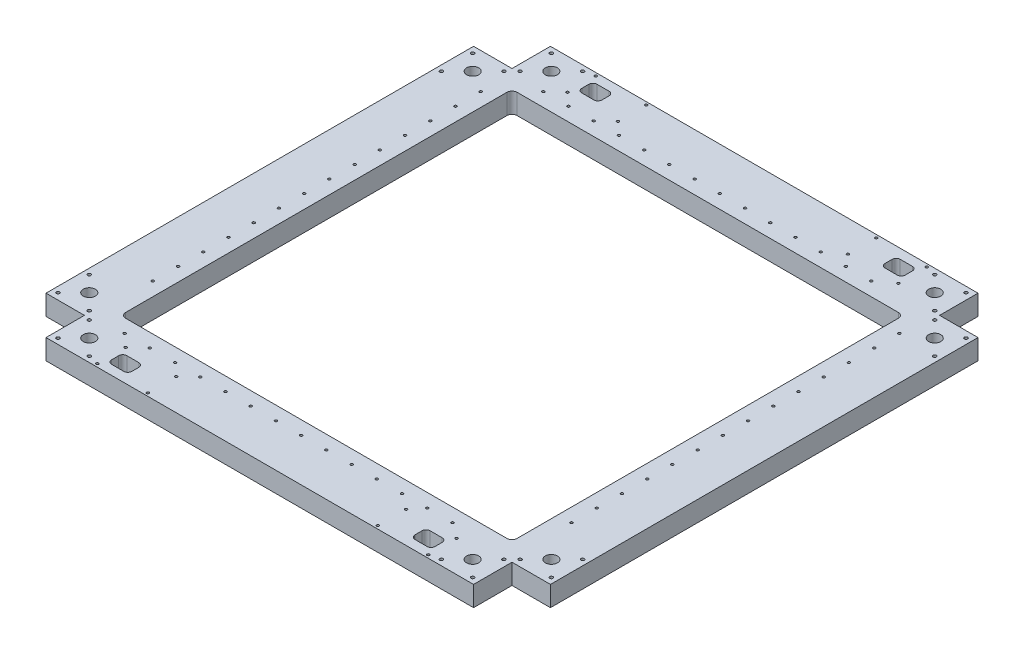
from build123d import *

# Parameters (mm, degrees)
SKETCH1_W                   = 500
SKETCH1_H                   = 500
BOSS_EXTRUDE1_DEPTH         = 20
BEARING_PRESS_FIT_D         = 12
CIRPATTERN1_COUNT           = 4
SKETCH5_W                   = 388
SKETCH5_H                   = 388
CUT_EXTRUDE1_DEPTH          = 20
SKETCH10_W                  = 428
SKETCH10_H                  = 428
SKETCH10_W_2                = 403
SKETCH10_H_2                = 403
LINEAR_RAIL_SLOT_DEPTH      = 2.5
FILLET2_R                   = 5
TAP_DRILL_FOR_M3X0_5_TAP1_D = 2.5
MIRROR6_COPY_1_D            = 2.5
BOSS_EXTRUDE2_DEPTH         = 2.5
CIRPATTERN4_COUNT           = 4
CUT_EXTRUDE3_DEPTH          = 355.118624193
TAP_DRILL_FOR_M3X0_5_TAP3_D = 2.5
MIRROR9_COPY_1_DEPTH        = 355.118624193
MIRROR9_COPY_2_D            = 2.5
M3_CLEARANCE_HOLE1_D        = 3.2
SKETCH27_W                  = 38.1
SKETCH27_H                  = 38.1
CUT_EXTRUDE4_DEPTH          = 20
CIRPATTERN3_COUNT           = 4
FILLET5_R                   = 4


with BuildPart() as part:
    # Sketch1 → Boss-Extrude1 (new body)
    with BuildSketch(Plane(origin=(0, 0, 0), x_dir=(1, 0, 0), z_dir=(0, 1, 0))):
        Rectangle(SKETCH1_W, SKETCH1_H)
    extrude(amount=BOSS_EXTRUDE1_DEPTH)

    # Bearing Press Fit (through all)
    with Locations(Plane(origin=(0, 20, 0), x_dir=(1, 0, 0), z_dir=(0, 1, 0))):
        with Locations((-190, 229), (-229, 190)):
            bearing_press_fit = Hole(BEARING_PRESS_FIT_D / 2)

    # CirPattern1: Bearing Press Fit ×4 about axis
    cirpattern1_axis = Axis((0, 0, 0), (0, 1, 0))
    for i in range(1, CIRPATTERN1_COUNT):
        add(bearing_press_fit.rotate(cirpattern1_axis, i * 360 / CIRPATTERN1_COUNT), mode=Mode.SUBTRACT)

    # Sketch5 → Cut-Extrude1 (cut)
    with BuildSketch(Plane(origin=(0, 20, 0), x_dir=(1, 0, 0), z_dir=(0, 1, 0))):
        Rectangle(SKETCH5_W, SKETCH5_H)
    extrude(amount=-CUT_EXTRUDE1_DEPTH, mode=Mode.SUBTRACT)

    # Sketch10 → Linear Rail Slot (cut)
    with BuildSketch(Plane(origin=(0, 0, 0), x_dir=(1, 0, 0), z_dir=(0, 1, 0))):
        Rectangle(SKETCH10_W, SKETCH10_H)
        Rectangle(SKETCH10_W_2, SKETCH10_H_2, mode=Mode.SUBTRACT)
    extrude(amount=LINEAR_RAIL_SLOT_DEPTH, mode=Mode.SUBTRACT)

    # Fillet2
    fillet2_edges = [part.edges().sort_by_distance(p)[0] for p in [
        (-194, 10, 194),
        (-194, 10, -194),
        (194, 10, -194),
        (194, 10, 194),
    ]]
    fillet(fillet2_edges, radius=FILLET2_R)

    # Tap Drill for M3x0.5 Tap1 (through all)
    with Locations(Plane(origin=(0, 2.5, 0), x_dir=(-1, 0, 0), z_dir=(0, -1, 0))):
        with Locations((-148.5, -207.5), (-123.5, -207.5), (-98.5, -207.5), (-73.5, -207.5), (-48.5, -207.5), (-23.5, -207.5), (1.5, -207.5), (26.5, -207.5), (51.5, -207.5), (76.5, -207.5), (101.5, -207.5), (126.5, -207.5), (151.5, -207.5), (176.5, -207.5)):
            tap_drill_for_m3x0_5_tap1 = Hole(TAP_DRILL_FOR_M3X0_5_TAP1_D / 2)

    # Mirror5: Tap Drill for M3x0.5 Tap1 across plane
    add(tap_drill_for_m3x0_5_tap1.mirror(Plane.XY), mode=Mode.SUBTRACT)

    # Mirror6: Tap Drill for M3x0.5 Tap1 across plane
    add(tap_drill_for_m3x0_5_tap1.mirror(Plane(origin=(0, 0, 0), x_dir=(0.7071067811865478, 0, 0.7071067811865472), z_dir=(-0.7071067811865475, 0, 0.7071067811865477))), mode=Mode.SUBTRACT)

    # Mirror6 copy 1 (through all)
    with Locations(Plane(origin=(0, 2.5, 0), x_dir=(0, 0, -1), z_dir=(0, -1, 0))):
        with Locations((-148.5, -207.5), (-123.5, -207.5), (-98.5, -207.5), (-73.5, -207.5), (-48.5, -207.5), (-23.5, -207.5), (1.5, -207.5), (26.5, -207.5), (51.5, -207.5), (76.5, -207.5), (101.5, -207.5), (126.5, -207.5), (151.5, -207.5), (176.5, -207.5)):
            Hole(MIRROR6_COPY_1_D / 2)

    # Sketch19 → Boss-Extrude2 (add)
    with BuildSketch(Plane.XZ.offset(-2.5)):
        Polygon((-198.5, 201.5), (-198.5, 214), (-214, 214), (-214, 198.5), (-201.5, 198.5), (-201.5, 201.5), align=None)
    boss_extrude2 = extrude(amount=BOSS_EXTRUDE2_DEPTH)

    # CirPattern4: Boss-Extrude2 ×4 about axis
    cirpattern4_axis = Axis((0, 0, 0), (0, 1, 0))
    for i in range(1, CIRPATTERN4_COUNT):
        add(boss_extrude2.rotate(cirpattern4_axis, i * 360 / CIRPATTERN4_COUNT))

    # Sketch20 → Cut-Extrude3 (cut, through all)
    with BuildSketch(Plane(origin=(0, 20, 0), x_dir=(1, 0, 0), z_dir=(0, 1, 0))):
        with BuildLine():
            Line((156.3, -240.5), (144.3, -240.5))
            ThreePointArc((144.3, -240.5), (141.471572875, -239.328427125), (140.3, -236.5))
            Line((140.3, -236.5), (140.3, -229.5))
            ThreePointArc((140.3, -229.5), (141.471572875, -226.671572875), (144.3, -225.5))
            Line((144.3, -225.5), (156.3, -225.5))
            ThreePointArc((156.3, -225.5), (159.128427125, -226.671572875), (160.3, -229.5))
            Line((160.3, -229.5), (160.3, -236.5))
            ThreePointArc((160.3, -236.5), (159.128427125, -239.328427125), (156.3, -240.5))
        make_face()
    cut_extrude3 = extrude(amount=-CUT_EXTRUDE3_DEPTH, mode=Mode.SUBTRACT)

    # Tap Drill for M3x0.5 Tap3 (through all)
    with Locations(Plane(origin=(0, 20, 0), x_dir=(1, 0, 0), z_dir=(0, 1, 0))):
        with Locations((164, -219), (164, -247), (114, -247), (114, -219)):
            tap_drill_for_m3x0_5_tap3 = Hole(TAP_DRILL_FOR_M3X0_5_TAP3_D / 2)

    # Mirror8: Cut-Extrude3, Tap Drill for M3x0.5 Tap3 across plane
    add(cut_extrude3.mirror(Plane(origin=(0, 0, 0), x_dir=(0, 0, 1), z_dir=(1, 0, 0))), mode=Mode.SUBTRACT)
    add(tap_drill_for_m3x0_5_tap3.mirror(Plane(origin=(0, 0, 0), x_dir=(0, 0, 1), z_dir=(1, 0, 0))), mode=Mode.SUBTRACT)

    # Mirror9: Cut-Extrude3, Tap Drill for M3x0.5 Tap3 across plane
    add(cut_extrude3.mirror(Plane.XY), mode=Mode.SUBTRACT)
    add(tap_drill_for_m3x0_5_tap3.mirror(Plane.XY), mode=Mode.SUBTRACT)

    # Mirror9 copy 1 sketch → Mirror9 copy 1 (cut, through all)
    with BuildSketch(Plane(origin=(0, 20, 0), x_dir=(-1, 0, 0), z_dir=(0, 1, 0))):
        with BuildLine():
            Line((156.3, -240.5), (144.3, -240.5))
            ThreePointArc((144.3, -240.5), (141.471572875, -239.328427125), (140.3, -236.5))
            Line((140.3, -236.5), (140.3, -229.5))
            ThreePointArc((140.3, -229.5), (141.471572875, -226.671572875), (144.3, -225.5))
            Line((144.3, -225.5), (156.3, -225.5))
            ThreePointArc((156.3, -225.5), (159.128427125, -226.671572875), (160.3, -229.5))
            Line((160.3, -229.5), (160.3, -236.5))
            ThreePointArc((160.3, -236.5), (159.128427125, -239.328427125), (156.3, -240.5))
        make_face()
    extrude(amount=-MIRROR9_COPY_1_DEPTH, mode=Mode.SUBTRACT)

    # Mirror9 copy 2 (through all)
    with Locations(Plane(origin=(0, 20, 0), x_dir=(-1, 0, 0), z_dir=(0, 1, 0))):
        with Locations((164, -219), (164, -247), (114, -247), (114, -219)):
            Hole(MIRROR9_COPY_2_D / 2)

    # M3 Clearance Hole1 (through all)
    with Locations(Plane(origin=(0, 20, 0), x_dir=(1, 0, 0), z_dir=(0, 1, 0))):
        with Locations((205.5, -244.5), (205.5, -213.5), (174.5, -244.5), (213.5, -205.5), (244.5, -174.5), (244.5, -205.5)):
            m3_clearance_hole1 = Hole(M3_CLEARANCE_HOLE1_D / 2)

    # Sketch27 → Cut-Extrude4 (cut)
    with BuildSketch(Plane(origin=(0, 20, 0), x_dir=(1, 0, 0), z_dir=(0, 1, 0))):
        with Locations((230.95, -230.95)):
            Rectangle(SKETCH27_W, SKETCH27_H)
    cut_extrude4 = extrude(amount=-CUT_EXTRUDE4_DEPTH, mode=Mode.SUBTRACT)

    # CirPattern3: M3 Clearance Hole1, Cut-Extrude4 ×4 about axis
    cirpattern3_axis = Axis((0, 0, 0), (0, 1, 0))
    add([m3_clearance_hole1.rotate(cirpattern3_axis, i * 360 / CIRPATTERN3_COUNT) for i in range(1, CIRPATTERN3_COUNT)], mode=Mode.SUBTRACT)
    add([cut_extrude4.rotate(cirpattern3_axis, i * 360 / CIRPATTERN3_COUNT) for i in range(1, CIRPATTERN3_COUNT)], mode=Mode.SUBTRACT)

    # Fillet5
    fillet5_edges = [part.edges().sort_by_distance(p)[0] for p in [
        (-201.5, 1.25, 198.5),
        (-214, 1.25, 198.5),
        (-198.5, 1.25, 214),
        (-198.5, 1.25, 201.5),
        (-198.5, 1.25, -201.5),
        (-198.5, 1.25, -214),
        (-214, 1.25, -198.5),
        (-201.5, 1.25, -198.5),
        (201.5, 1.25, -198.5),
        (214, 1.25, -198.5),
        (198.5, 1.25, -214),
        (198.5, 1.25, -201.5),
        (198.5, 1.25, 201.5),
        (198.5, 1.25, 214),
        (214, 1.25, 198.5),
        (201.5, 1.25, 198.5),
    ]]
    fillet(fillet5_edges, radius=FILLET5_R)


solid = part.part
